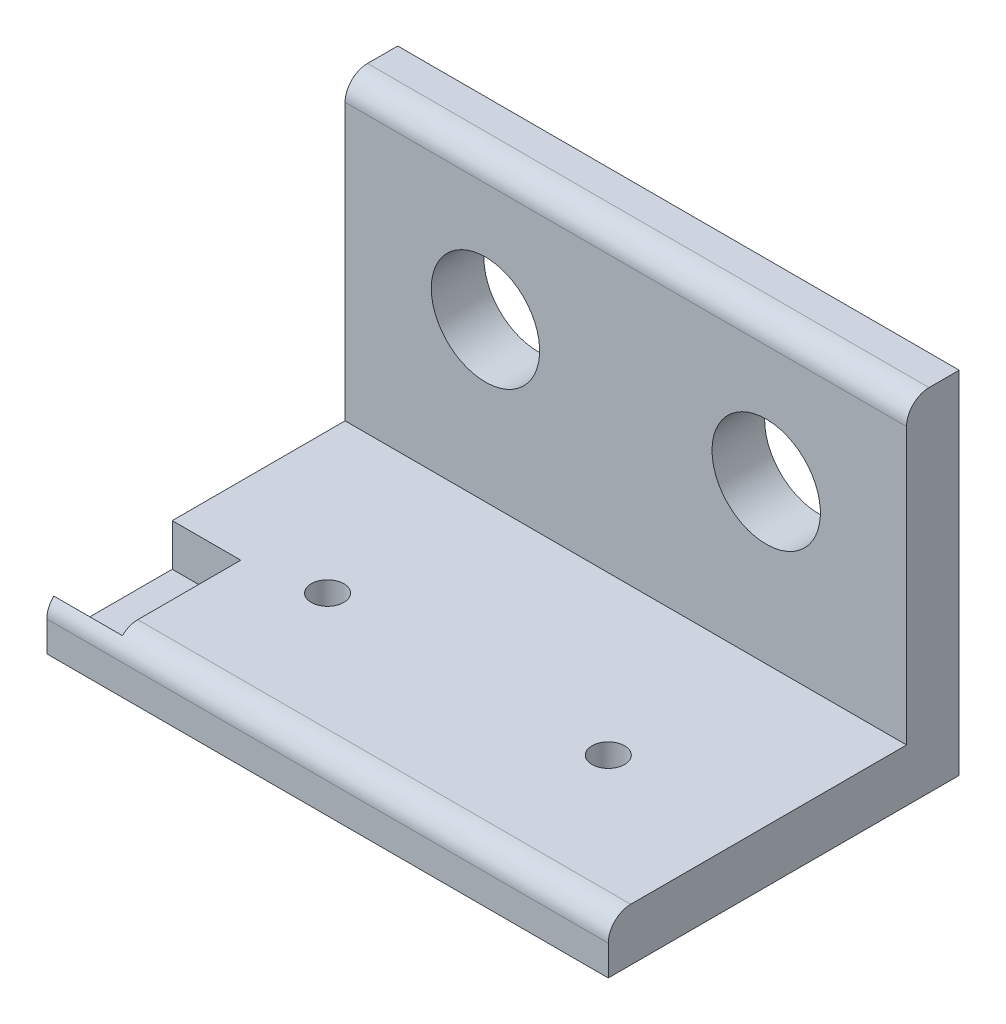
from build123d import *

# Parameters (mm, degrees)
SKETCH1_W                   = 50.8
SKETCH1_H                   = 31.75
BASE_LEG_DEPTH              = 4.7625
SKETCH2_W                   = 50.8
SKETCH2_H                   = 31.75
PERPENDICULAR_LEG_DEPTH     = 4.7625
FILLET1_R                   = 2.032
F_32_0_116_DIAMETER_HOLE1_D = 2.9464
W_0_386_DIAMETER_HOLE1_D    = 9.8044
SKETCH15_W                  = 6.549717957
SKETCH15_H                  = 10.713777056
CUT_EXTRUDE2_DEPTH          = 3.81


with BuildPart() as part:
    # Sketch1 → Base leg (new body)
    with BuildSketch(Plane(origin=(0, 0, 0), x_dir=(1, 0, 0), z_dir=(0, 1, 0))):
        with Locations((25.4, -15.875)):
            Rectangle(SKETCH1_W, SKETCH1_H)
    extrude(amount=BASE_LEG_DEPTH)

    # Sketch2 → Perpendicular leg (add)
    with BuildSketch(Plane.XY):
        with Locations((25.4, 15.875)):
            Rectangle(SKETCH2_W, SKETCH2_H)
    extrude(amount=PERPENDICULAR_LEG_DEPTH)

    # Fillet1
    fillet1_edges = [part.edges().sort_by_distance(p)[0] for p in [
        (25.4, 31.75, 4.7625),
        (25.4, 4.7625, 31.75),
    ]]
    fillet(fillet1_edges, radius=FILLET1_R)

    # #32 (0.116) Diameter Hole1 (through all)
    with Locations(Plane(origin=(0, 0, 0), x_dir=(-1, 0, 0), z_dir=(0, -1, 0))):
        with Locations((-38.1, -19.05), (-12.7, -19.05)):
            Hole(F_32_0_116_DIAMETER_HOLE1_D / 2)

    # W (0.386) Diameter Hole1 (through all)
    with Locations(Plane(origin=(0, 0, 0), x_dir=(-1, 0, 0), z_dir=(0, 0, -1))):
        with Locations((-12.7, 19.05), (-38.1, 19.05)):
            Hole(W_0_386_DIAMETER_HOLE1_D / 2)

    # Sketch15 → Cut-Extrude2 (cut)
    with BuildSketch(Plane(origin=(0, 4.7625, 0), x_dir=(1, 0, 0), z_dir=(0, 1, 0))):
        with Locations((2.926349869, -25.756092966)):
            Rectangle(SKETCH15_W, SKETCH15_H)
    extrude(amount=-CUT_EXTRUDE2_DEPTH, mode=Mode.SUBTRACT)


solid = part.part
